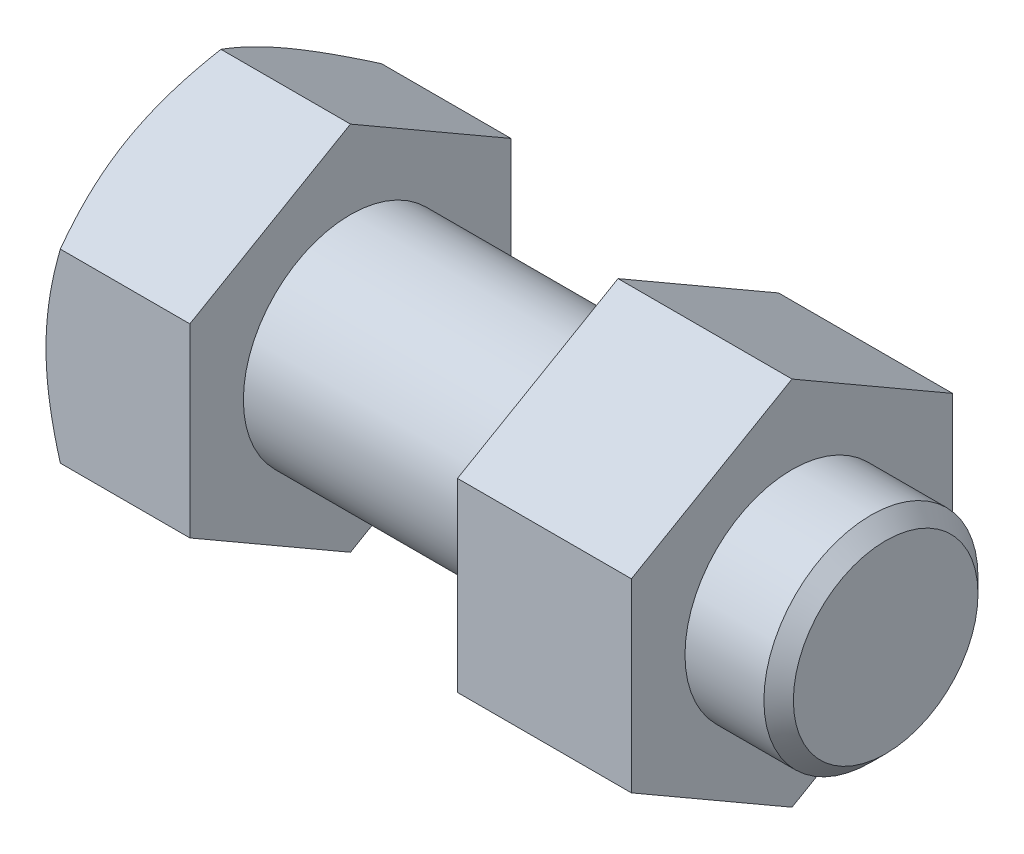
from build123d import *

# Parameters (mm, degrees)
BASEHEAD_DEPTH      = 10.75
BOSS_EXTRUDE1_DEPTH = 13


with BuildPart() as part:
    # Sketch1 → BaseHead (new body)
    with BuildSketch(Plane(origin=(0, 0, 0), x_dir=(0, 0, -1), z_dir=(1, 0, 0))):
        Polygon((12, 6.92820323), (12, -6.92820323), (0, -13.856406461), (-12, -6.92820323), (-12, 6.92820323), (0, 13.856406461), align=None)
    extrude(amount=BASEHEAD_DEPTH)

    # BodySke → BaseBody (revolve)
    with BuildSketch(Plane.XY, mode=Mode.PRIVATE) as basebody_sk:
        Polygon((0, 0), (50.75, 0), (50.75, 6.8985), (49.6485, 8), (0, 8), align=None)
    revolve(basebody_sk.sketch.rotate(Axis((0, 0, 0), (1, 0, 0)), 90), axis=Axis((0, 0, 0), (1, 0, 0)))

    # Sketch3 → HeadChamfer (revolve, cut)
    with BuildSketch(Plane.XY):
        Polygon((0, 12), (3.958548116, 18.856406461), (3.958548116, 23.856406461), (-10, 23.856406461), (-10, 12), align=None)
    revolve(axis=Axis((0, 0, 0), (1, 0, 0)), mode=Mode.SUBTRACT)

    # Sketch4 → Boss-Extrude1 (add)
    with BuildSketch(Plane(origin=(30.75, 0, 0), x_dir=(0, 0, -1), z_dir=(1, 0, 0))):
        Polygon((0, 13.856406461), (-12, 6.92820323), (-12, -6.92820323), (0, -13.856406461), (12, -6.92820323), (12, 6.92820323), align=None)
    extrude(amount=BOSS_EXTRUDE1_DEPTH)


solid = part.part
